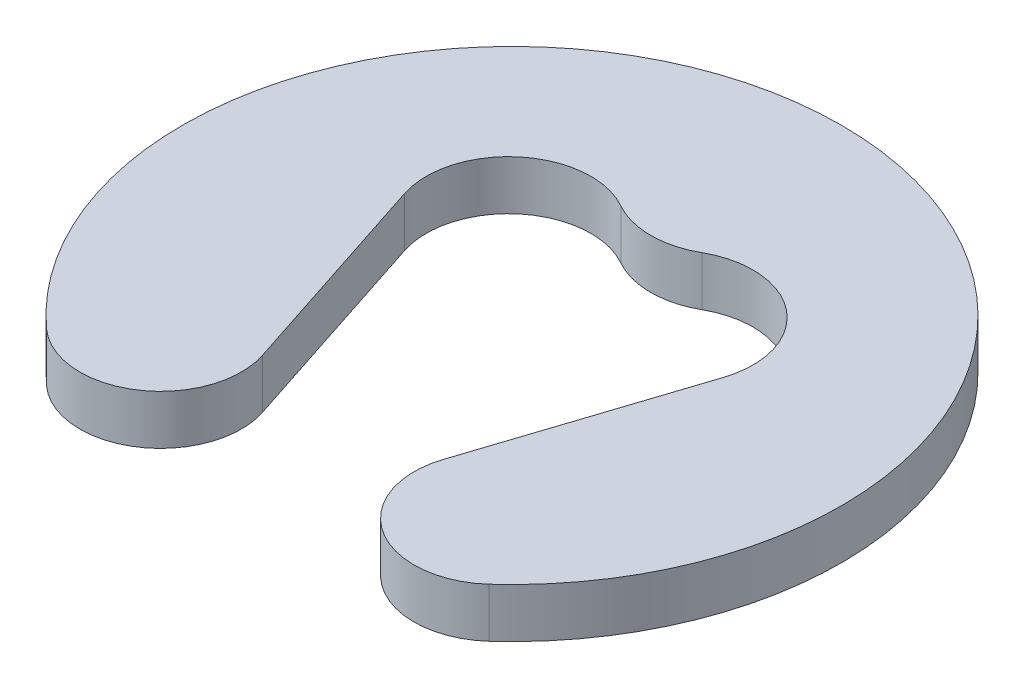
from build123d import *

# Parameters (mm, degrees)
SKETCH1_R           = 2
BOSS_EXTRUDE1_DEPTH = 0.15
CUT_EXTRUDE1_DEPTH  = 0.3


with BuildPart() as part:
    # Sketch1 → Boss-Extrude1 (new, symmetric)
    with BuildSketch(Plane(origin=(0, 0, 0), x_dir=(1, 0, 0), z_dir=(0, 1, 0))):
        with Locations(Location((0, 0, 0), (0, 0, 270))):
            Circle(SKETCH1_R)
    extrude(amount=BOSS_EXTRUDE1_DEPTH, both=True)

    # Sketch2 → Cut-Extrude1 (cut)
    with BuildSketch(Plane(origin=(0, 0.15, 0), x_dir=(1, 0, 0), z_dir=(0, 1, 0))):
        with BuildLine():
            Line((-0.967148548, 0.315751436), (-0.548029651, -0.966248909))
            ThreePointArc((-0.548029651, -0.966248909), (-0.747308894, -1.529930389), (-1.34323828, -1.481793145))
            ThreePointArc((-1.34323828, -1.481793145), (0, -2), (1.34323828, -1.481793145))
            ThreePointArc((1.34323828, -1.481793145), (0.747308894, -1.529930389), (0.548029651, -0.966248909))
            Line((0.548029651, -0.966248909), (0.967148548, 0.315751436))
            ThreePointArc((0.967148548, 0.315751436), (0.808720922, 0.8579363), (0.245950629, 0.9064475))
            ThreePointArc((0.245950629, 0.9064475), (0, 0.841772997), (-0.245950629, 0.9064475))
            ThreePointArc((-0.245950629, 0.9064475), (-0.808720922, 0.8579363), (-0.967148548, 0.315751436))
        make_face()
    extrude(amount=-CUT_EXTRUDE1_DEPTH, mode=Mode.SUBTRACT)


solid = part.part
